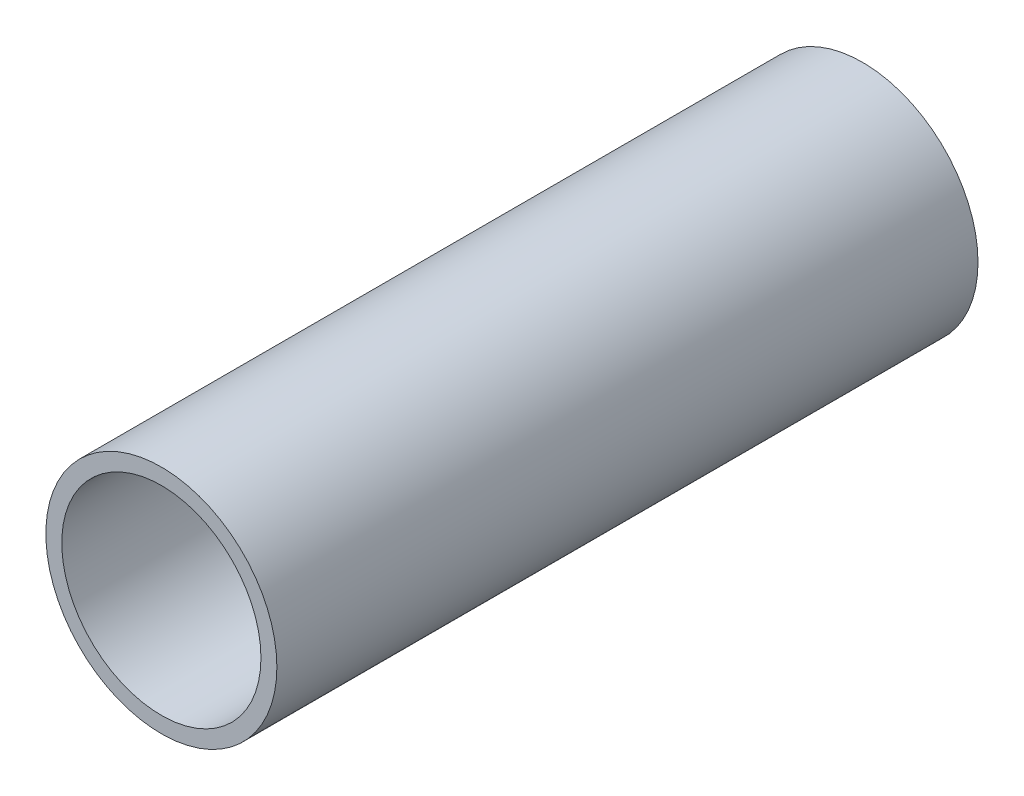
from build123d import *

# Parameters (mm, degrees)
SKETCH1_R           = 14.5
SKETCH1_R_2         = 12.5
BOSS_EXTRUDE1_DEPTH = 88


with BuildPart() as part:
    # Sketch1 → Boss-Extrude1 (new body)
    with BuildSketch(Plane.XY):
        Circle(SKETCH1_R)
        Circle(SKETCH1_R_2, mode=Mode.SUBTRACT)
    extrude(amount=BOSS_EXTRUDE1_DEPTH)


solid = part.part
